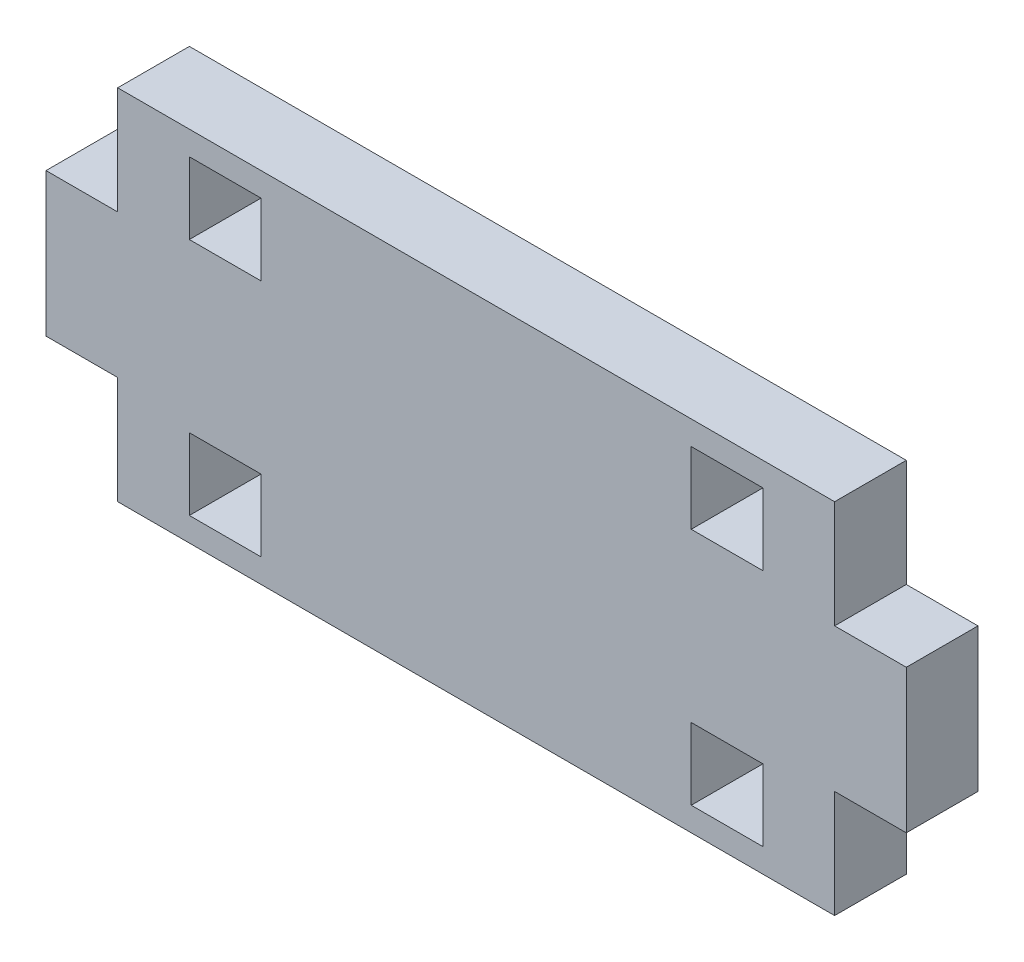
from build123d import *

# Parameters (mm, degrees)
SKETCH1_W           = 3
SKETCH1_H           = 3
BOSS_EXTRUDE1_DEPTH = 3


with BuildPart() as part:
    # Sketch1 → Boss-Extrude1 (new body)
    with BuildSketch(Plane.XY):
        Polygon((-16, 3.49861258), (-13, 3.49861258), (-13, 7.99861258), (17, 7.99861258), (17, 3.49861258), (20, 3.49861258), (20, -2.50138742), (17, -2.50138742), (17, -7.00138742), (-13, -7.00138742), (-13, -2.50138742), (-16, -2.50138742), align=None)
        with Locations((-8.502036486, 5.49861258)):
            Rectangle(SKETCH1_W, SKETCH1_H, mode=Mode.SUBTRACT)
        with Locations((-8.502036486, -4.50138742)):
            Rectangle(SKETCH1_W, SKETCH1_H, mode=Mode.SUBTRACT)
        with Locations((12.5, 5.49861258)):
            Rectangle(SKETCH1_W, SKETCH1_H, mode=Mode.SUBTRACT)
        with Locations((12.5, -4.50138742)):
            Rectangle(SKETCH1_W, SKETCH1_H, mode=Mode.SUBTRACT)
    extrude(amount=BOSS_EXTRUDE1_DEPTH)


solid = part.part
